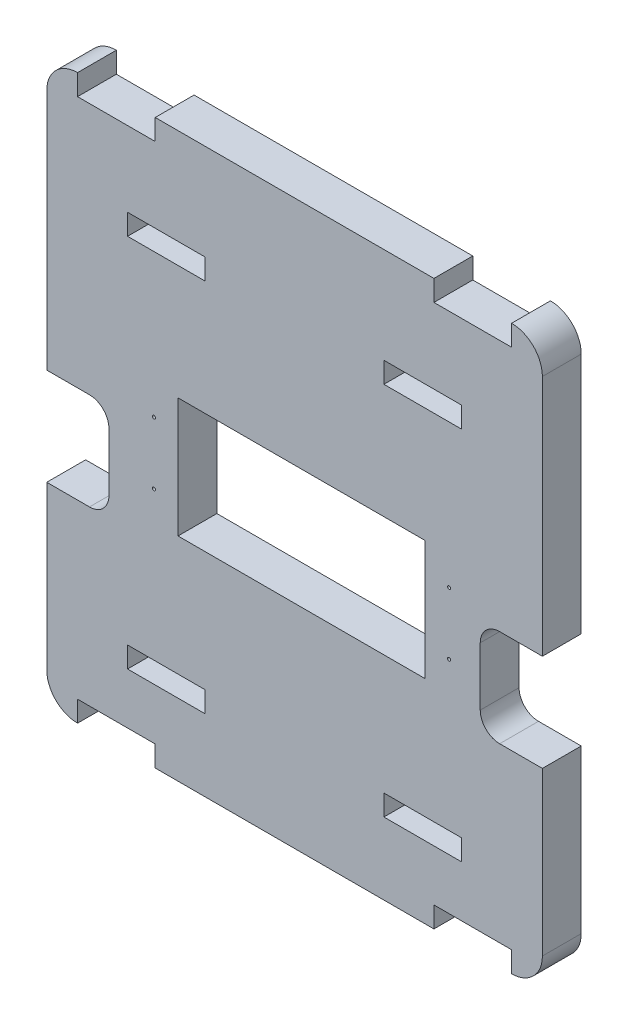
from build123d import *

# Parameters (mm, degrees)
SKETCH1_R           = 0.254
SKETCH1_W           = 12.7
SKETCH1_H           = 3.4036
SKETCH1_W_2         = 40.386
SKETCH1_H_2         = 19.558
BOSS_EXTRUDE1_DEPTH = 6.35


with BuildPart() as part:
    # Sketch1 → Boss-Extrude1 (new body)
    with BuildSketch(Plane.XY):
        with BuildLine():
            Line((6728.635399657, 3585.149709448), (6728.635399657, 3545.54033771))
            Line((6728.635399657, 3545.54033771), (6735.620399657, 3545.54033771))
            ThreePointArc((6735.620399657, 3545.54033771), (6737.865463687, 3544.61040174), (6738.795399657, 3542.36533771))
            Line((6738.795399657, 3542.36533771), (6738.795399657, 3532.84033771))
            ThreePointArc((6738.795399657, 3532.84033771), (6737.865463687, 3530.595273679), (6735.620399657, 3529.66533771))
            Line((6735.620399657, 3529.66533771), (6728.635399657, 3529.66533771))
            Line((6728.635399657, 3529.66533771), (6728.635399657, 3503.09693771))
            ThreePointArc((6728.635399657, 3503.09693771), (6730.108418233, 3499.540756286), (6733.664599657, 3498.06773771))
            Line((6733.664599657, 3498.06773771), (6733.664599657, 3501.47133771))
            Line((6733.664599657, 3501.47133771), (6746.364599657, 3501.47133771))
            Line((6746.364599657, 3501.47133771), (6746.364599657, 3498.06773771))
            Line((6746.364599657, 3498.06773771), (6791.932199657, 3498.06773771))
            Line((6791.932199657, 3498.06773771), (6791.932199657, 3501.47133771))
            Line((6791.932199657, 3501.47133771), (6804.632199657, 3501.47133771))
            Line((6804.632199657, 3501.47133771), (6804.632199657, 3498.06773771))
            ThreePointArc((6804.632199657, 3498.06773771), (6808.188381081, 3499.540756286), (6809.661399657, 3503.09693771))
            Line((6809.661399657, 3503.09693771), (6809.661399657, 3529.66533771))
            Line((6809.661399657, 3529.66533771), (6802.676399657, 3529.66533771))
            ThreePointArc((6802.676399657, 3529.66533771), (6800.431335626, 3530.595273679), (6799.501399657, 3532.84033771))
            Line((6799.501399657, 3532.84033771), (6799.501399657, 3542.36533771))
            ThreePointArc((6799.501399657, 3542.36533771), (6800.431335626, 3544.61040174), (6802.676399657, 3545.54033771))
            Line((6802.676399657, 3545.54033771), (6809.661399657, 3545.54033771))
            Line((6809.661399657, 3545.54033771), (6809.661399657, 3585.149709448))
            ThreePointArc((6809.661399657, 3585.149709448), (6808.188381081, 3588.705890872), (6804.632199657, 3590.178909448))
            Line((6804.632199657, 3590.178909448), (6804.632199657, 3586.775309448))
            Line((6804.632199657, 3586.775309448), (6791.932199657, 3586.775309448))
            Line((6791.932199657, 3586.775309448), (6791.932199657, 3590.178909448))
            Line((6791.932199657, 3590.178909448), (6746.364599657, 3590.178909448))
            Line((6746.364599657, 3590.178909448), (6746.364599657, 3586.775309448))
            Line((6746.364599657, 3586.775309448), (6733.664599657, 3586.775309448))
            Line((6733.664599657, 3586.775309448), (6733.664599657, 3590.178909448))
            ThreePointArc((6733.664599657, 3590.178909448), (6730.108418233, 3588.705890872), (6728.635399657, 3585.149709448))
        make_face()
        with Locations((6794.416327778, 3547.648139787)):
            Circle(SKETCH1_R, mode=Mode.SUBTRACT)
        with Locations((6794.416327778, 3537.488139787)):
            Circle(SKETCH1_R, mode=Mode.SUBTRACT)
        with Locations((6746.156327778, 3547.648139787)):
            Circle(SKETCH1_R, mode=Mode.SUBTRACT)
        with Locations((6746.156327778, 3537.488139787)):
            Circle(SKETCH1_R, mode=Mode.SUBTRACT)
        with Locations((6748.193399657, 3511.52973771)):
            Rectangle(SKETCH1_W, SKETCH1_H, mode=Mode.SUBTRACT)
        with Locations((6790.103399657, 3511.52973771)):
            Rectangle(SKETCH1_W, SKETCH1_H, mode=Mode.SUBTRACT)
        with Locations((6790.103399657, 3572.79453771)):
            Rectangle(SKETCH1_W, SKETCH1_H, mode=Mode.SUBTRACT)
        with Locations((6748.193399657, 3572.79453771)):
            Rectangle(SKETCH1_W, SKETCH1_H, mode=Mode.SUBTRACT)
        with Locations((6770.286327778, 3542.568139787)):
            Rectangle(SKETCH1_W_2, SKETCH1_H_2, mode=Mode.SUBTRACT)
    extrude(amount=BOSS_EXTRUDE1_DEPTH)


solid = part.part
